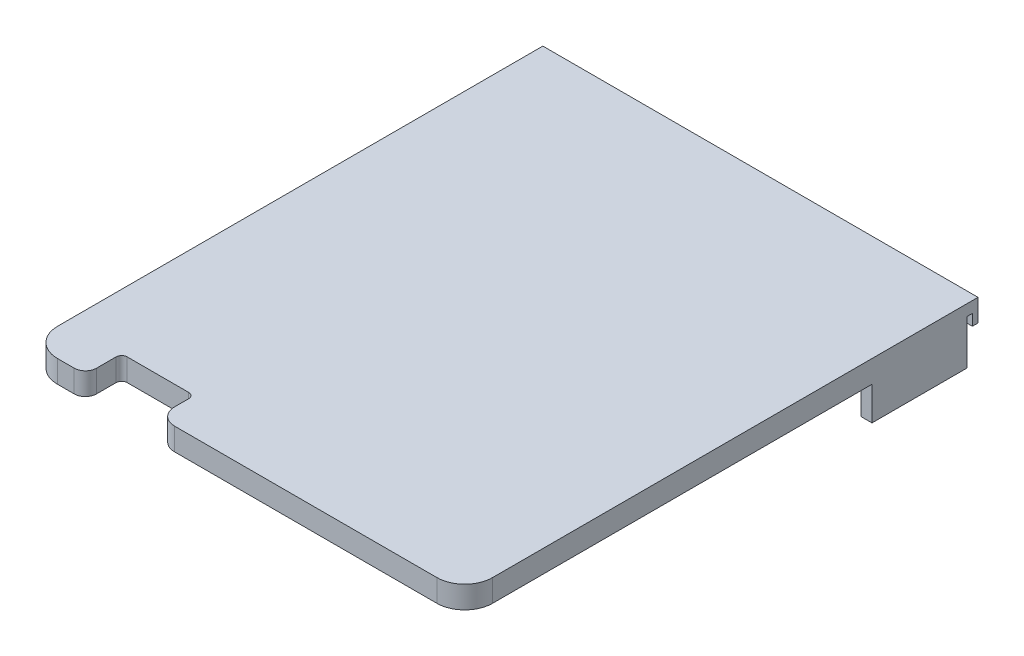
from build123d import *

# Parameters (mm, degrees)
EXTRUDE_1_DEPTH = 2
EXTRUDE_START   = -4
SKETCH_2_W      = 78
SKETCH_2_H      = 1
EXTRUDE_2_DEPTH = 4
SKETCH_3_W      = 2
SKETCH_3_H      = 17.002857219
EXTRUDE_4_DEPTH = 10
SKETCH_5_W      = 1
SKETCH_5_H      = 1
EXTRUDE_6_DEPTH = 2


with BuildPart() as part:
    # Эскиз1 → Бобышка-Вытянуть1 (new body)
    with BuildSketch(Plane(origin=(0, 0, 0), x_dir=(1, 0, 0), z_dir=(0, 1, 0))):
        with BuildLine():
            Line((-39.421663854, 15.772857219), (-39.421663854, -47.227142781))
            ThreePointArc((-39.421663854, -47.227142781), (-38.250090979, -50.055569906), (-35.421663854, -51.227142781))
            Line((-35.421663854, -51.227142781), (-32.421663854, -51.227142781))
            ThreePointArc((-32.421663854, -51.227142781), (-31.714557073, -50.934249562), (-31.421663854, -50.227142781))
            Line((-31.421663854, -50.227142781), (-31.421663854, -46.727142781))
            ThreePointArc((-31.421663854, -46.727142781), (-30.835877417, -45.312929219), (-29.421663854, -44.727142781))
            Line((-29.421663854, -44.727142781), (-18.421663854, -44.727142781))
            ThreePointArc((-18.421663854, -44.727142781), (-17.007450292, -45.312929219), (-16.421663854, -46.727142781))
            Line((-16.421663854, -46.727142781), (-16.421663854, -49.227142781))
            ThreePointArc((-16.421663854, -49.227142781), (-15.835877417, -50.641356343), (-14.421663854, -51.227142781))
            Line((-14.421663854, -51.227142781), (21.578336146, -51.227142781))
            Line((21.578336146, -51.227142781), (32.578336146, -51.227142781))
            ThreePointArc((32.578336146, -51.227142781), (35.40676327, -50.055569906), (36.578336146, -47.227142781))
            Line((36.578336146, -47.227142781), (36.578336146, 15.772857219))
            Line((36.578336146, 15.772857219), (36.578336146, 38.772857219))
            Line((36.578336146, 38.772857219), (-39.421663854, 38.772857219))
            Line((-39.421663854, 38.772857219), (-39.421663854, 15.772857219))
        make_face()
    extrude(amount=EXTRUDE_1_DEPTH)

    # Эскиз2 → Бобышка-Вытянуть2 (add)
    with BuildSketch(Plane(origin=(0, 2, 0), x_dir=(1, 0, 0), z_dir=(0, 1, 0)).offset(EXTRUDE_START)):
        with BuildLine():
            Line((-35.421663854, -51.227142781), (-32.421663854, -51.227142781))
            ThreePointArc((-32.421663854, -51.227142781), (-31.714557073, -50.934249562), (-31.421663854, -50.227142781))
            Line((-31.421663854, -50.227142781), (-31.421663854, -46.727142781))
            ThreePointArc((-31.421663854, -46.727142781), (-30.835877417, -45.312929219), (-29.421663854, -44.727142781))
            Line((-29.421663854, -44.727142781), (-18.421663854, -44.727142781))
            ThreePointArc((-18.421663854, -44.727142781), (-17.007450292, -45.312929219), (-16.421663854, -46.727142781))
            Line((-16.421663854, -46.727142781), (-16.421663854, -49.227142781))
            ThreePointArc((-16.421663854, -49.227142781), (-15.835877417, -50.641356343), (-14.421663854, -51.227142781))
            Line((-14.421663854, -51.227142781), (32.578336146, -51.227142781))
            ThreePointArc((32.578336146, -51.227142781), (35.40676327, -50.055569906), (36.578336146, -47.227142781))
            Line((36.578336146, -47.227142781), (36.578336146, 15.772857219))
            Line((36.578336146, 15.772857219), (36.578336146, 21.77))
            Line((36.578336146, 21.77), (37.578336146, 21.77))
            Line((37.578336146, 21.77), (37.578336146, 15.772857219))
            Line((37.578336146, 15.772857219), (37.578336146, -47.227142781))
            ThreePointArc((37.578336146, -47.227142781), (36.113870052, -50.762676687), (32.578336146, -52.227142781))
            Line((32.578336146, -52.227142781), (-14.421663854, -52.227142781))
            ThreePointArc((-14.421663854, -52.227142781), (-16.542984198, -51.348463125), (-17.421663854, -49.227142781))
            Line((-17.421663854, -49.227142781), (-17.421663854, -46.727142781))
            ThreePointArc((-17.421663854, -46.727142781), (-17.714557073, -46.020036), (-18.421663854, -45.727142781))
            Line((-18.421663854, -45.727142781), (-29.421663854, -45.727142781))
            ThreePointArc((-29.421663854, -45.727142781), (-30.128770635, -46.020036), (-30.421663854, -46.727142781))
            Line((-30.421663854, -46.727142781), (-30.421663854, -50.227142781))
            ThreePointArc((-30.421663854, -50.227142781), (-31.007450292, -51.641356343), (-32.421663854, -52.227142781))
            Line((-32.421663854, -52.227142781), (-35.421663854, -52.227142781))
            ThreePointArc((-35.421663854, -52.227142781), (-38.95719776, -50.762676687), (-40.421663854, -47.227142781))
            Line((-40.421663854, -47.227142781), (-40.421663854, 15.772857219))
            Line((-40.421663854, 15.772857219), (-40.421663854, 21.77))
            Line((-40.421663854, 21.77), (-39.421663854, 21.77))
            Line((-39.421663854, 21.77), (-39.421663854, 15.772857219))
            Line((-39.421663854, 15.772857219), (-39.421663854, -47.227142781))
            ThreePointArc((-39.421663854, -47.227142781), (-38.250090979, -50.055569906), (-35.421663854, -51.227142781))
        make_face()
        with Locations((-1.421663854, 39.272857219)):
            Rectangle(SKETCH_2_W, SKETCH_2_H)
    extrude(amount=EXTRUDE_2_DEPTH)

    # Эскиз3 → Бобышка-Вытянуть4 (add)
    with BuildSketch(Plane(origin=(0, 2, 0), x_dir=(1, 0, 0), z_dir=(0, 1, 0))):
        with Locations((-39.421663854, 29.271428609)):
            Rectangle(SKETCH_3_W, SKETCH_3_H)
        with Locations((36.578336146, 29.271428609)):
            Rectangle(SKETCH_3_W, SKETCH_3_H)
    extrude(amount=-EXTRUDE_4_DEPTH)

    # Эскиз5 → Бобышка-Вытянуть6 (add)
    with BuildSketch(Plane(origin=(0, 2, 0), x_dir=(1, 0, 0), z_dir=(0, 1, 0))):
        with Locations((-39.921663854, 38.272857219)):
            Rectangle(SKETCH_5_W, SKETCH_5_H)
        with Locations((37.078336146, 38.272857219)):
            Rectangle(SKETCH_5_W, SKETCH_5_H)
    extrude(amount=-EXTRUDE_6_DEPTH)


solid = part.part
